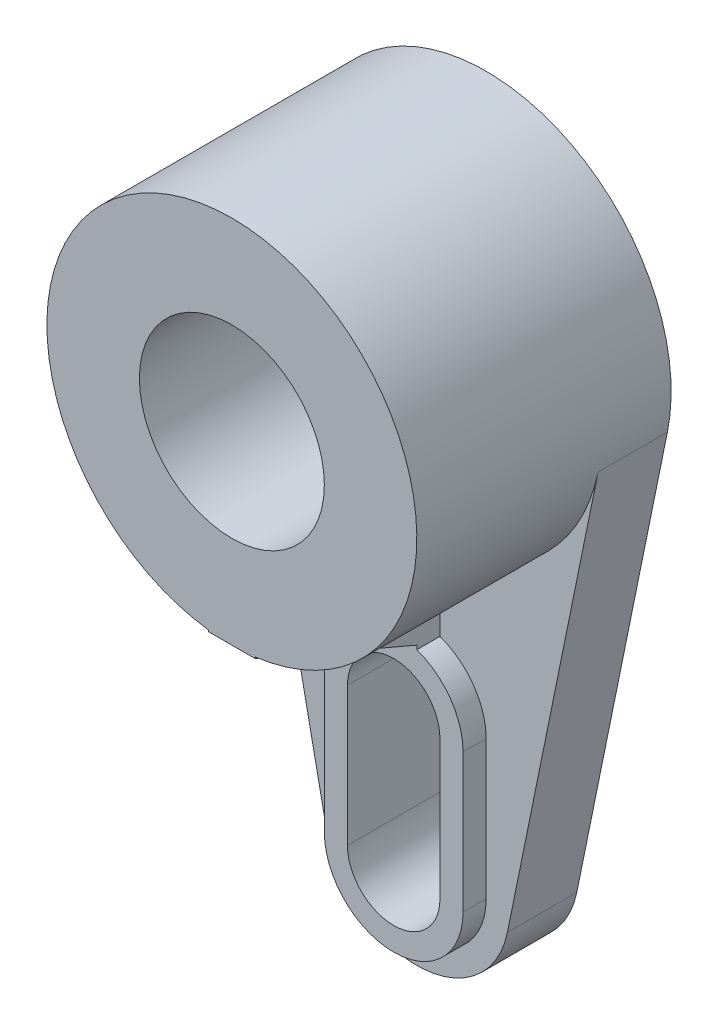
from build123d import *

# Parameters (mm, degrees)
BOSS_EXTRUDE1_DEPTH = 15
BOSS_EXTRUDE2_DEPTH = 20
SKETCH1_4_R         = 20
BOSS_EXTRUDE3_DEPTH = 55
BOSS_EXTRUDE6_DEPTH = 5


with BuildPart() as part:
    # Sketch1 → Boss-Extrude1 (new body)
    with BuildSketch(Plane(origin=(0, 0, 0), x_dir=(0, 1, 0), z_dir=(0, 0, 1))):
        with BuildLine():
            Line((-8, 39.191835885), (-104, 19.595917942))
            ThreePointArc((-104, 19.595917942), (-120, 0), (-104, -19.595917942))
            Line((-104, -19.595917942), (-8, -39.191835885))
            ThreePointArc((-8, -39.191835885), (-40, 0), (-8, 39.191835885))
        make_face()
        with BuildLine():
            ThreePointArc((-100, -15), (-115, 0), (-100, 15))
            Line((-100, 15), (-70, 15))
            ThreePointArc((-70, 15), (-55, 0), (-70, -15))
            Line((-70, -15), (-100, -15))
        make_face(mode=Mode.SUBTRACT)
    extrude(amount=BOSS_EXTRUDE1_DEPTH)

    # Sketch1<3> → Boss-Extrude2 (add)
    with BuildSketch(Plane(origin=(0, 0, 0), x_dir=(0, 1, 0), z_dir=(0, 0, 1))):
        with BuildLine():
            Line((-70, 15), (-100, 15))
            ThreePointArc((-100, 15), (-115, 0), (-100, -15))
            Line((-100, -15), (-70, -15))
            ThreePointArc((-70, -15), (-55, 0), (-70, 15))
        make_face()
        with BuildLine():
            ThreePointArc((-100, -10), (-110, 0), (-100, 10))
            Line((-100, 10), (-70, 10))
            ThreePointArc((-70, 10), (-60, 0), (-70, -10))
            Line((-70, -10), (-100, -10))
        make_face(mode=Mode.SUBTRACT)
    extrude(amount=BOSS_EXTRUDE2_DEPTH)

    # Sketch1<4> → Boss-Extrude3 (add)
    with BuildSketch(Plane(origin=(0, 0, 0), x_dir=(0, 1, 0), z_dir=(0, 0, 1))):
        with BuildLine():
            ThreePointArc((40, 0), (25.298221281, 30.98386677), (-8, 39.191835885))
            ThreePointArc((-8, 39.191835885), (-40, 0), (-8, -39.191835885))
            ThreePointArc((-8, -39.191835885), (25.298221281, -30.98386677), (40, 0))
        make_face()
        Circle(SKETCH1_4_R, mode=Mode.SUBTRACT)
    extrude(amount=BOSS_EXTRUDE3_DEPTH)

    # Sketch2 → Boss-Extrude6 (add, symmetric)
    with BuildSketch(Plane.YZ):
        Polygon((-55, 20), (-40, 55), (-39, 55), (-39, 15), (-56, 15), (-56, 20), align=None)
    extrude(amount=BOSS_EXTRUDE6_DEPTH, both=True)


solid = part.part
